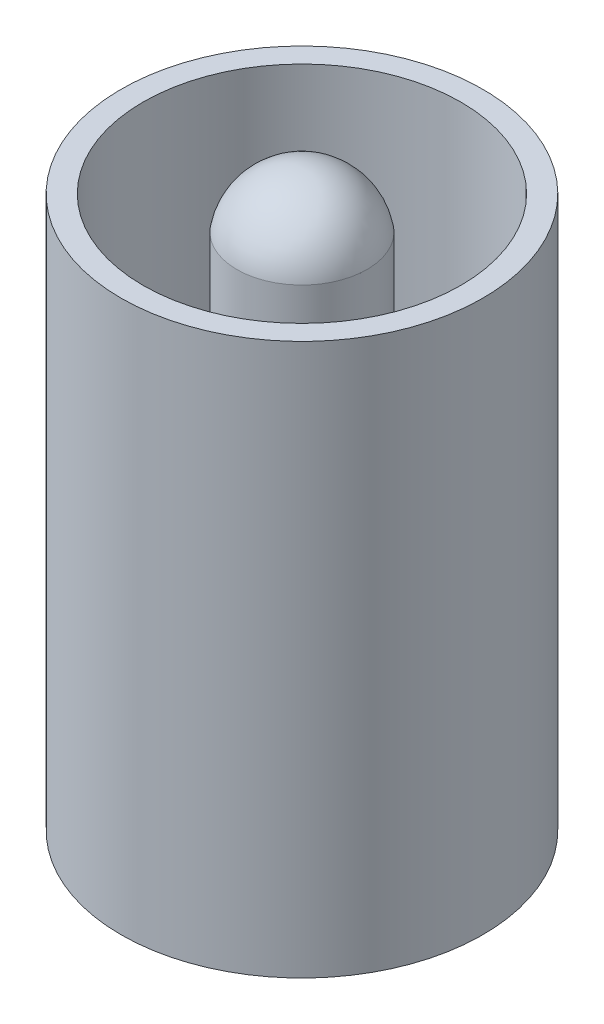
from build123d import *

# Parameters (mm, degrees)
SKETCH1_R           = 4.1671875
BOSS_EXTRUDE1_DEPTH = 12.7
SHELL1_T            = -0.508
SKETCH2_R           = 1.5
BOSS_EXTRUDE2_DEPTH = 11.43
DOME1_FACE_RADIUS   = 1.5
DOME1_HEIGHT        = 1.27


with BuildPart() as part:
    # Sketch1 → Boss-Extrude1 (new body)
    with BuildSketch(Plane(origin=(0, 0, 0), x_dir=(1, 0, 0), z_dir=(0, 1, 0))):
        with Locations(Location((0, 0, 0), (0, 0, 270))):
            Circle(SKETCH1_R)
    extrude(amount=BOSS_EXTRUDE1_DEPTH)

    # Shell1
    shell1_openings = [part.faces().sort_by_distance(p)[0] for p in [
        (0, 12.7, 0),
    ]]
    offset(amount=SHELL1_T, openings=shell1_openings, kind=Kind.INTERSECTION)

    # Sketch2 → Boss-Extrude2 (add)
    with BuildSketch(Plane(origin=(0, 0.508, 0), x_dir=(1, 0, 0), z_dir=(0, 1, 0))):
        with Locations(Location((0, 0, 0), (0, 0, 270))):
            Circle(SKETCH2_R)
    extrude(amount=BOSS_EXTRUDE2_DEPTH)

    # Dome1: a dome of height H over a round flat face of radius A is a cap of a sphere of radius (A * A + H * H) / (2 * H)
    dome1_r = (DOME1_FACE_RADIUS * DOME1_FACE_RADIUS + DOME1_HEIGHT * DOME1_HEIGHT) / (2 * DOME1_HEIGHT)
    dome1_base = Plane((0, 11.938, 0), z_dir=(0, 1, 0))
    with Locations(dome1_base.offset(DOME1_HEIGHT - dome1_r)):
        dome1_ball = Sphere(dome1_r, mode=Mode.PRIVATE)
    add(split(dome1_ball, bisect_by=dome1_base, keep=Keep.TOP, mode=Mode.PRIVATE))


solid = part.part
